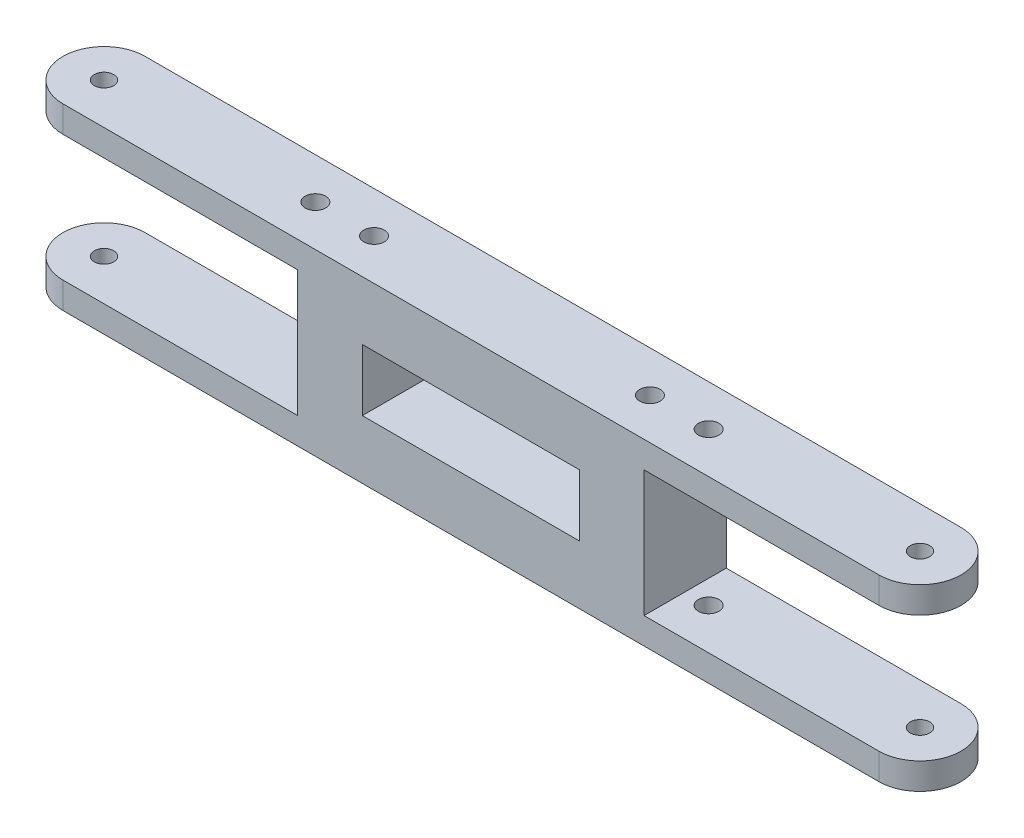
from build123d import *

# Parameters (mm, degrees)
SKETCH_1_R          = 1.65
SKETCH_1_R_2        = 1.75
EXTRUDE_1_DEPTH     = 30.5
CUT_EXTRUDE_1_DEPTH = 62.051208014
SKETCH_3_W          = 20
SKETCH_3_H          = 10.5
CUT_EXTRUDE_2_DEPTH = 62.051208014
SKETCH_4_W          = 18.5
SKETCH_4_H          = 10
EXTRUDE_2_DEPTH     = 14
SKETCH_5_W          = 11
SKETCH_5_H          = 10.5
EXTRUDE_3_DEPTH     = 14


with BuildPart() as part:
    # ｽｹｯﾁ1 → ﾎﾞｽ - 押し出し1 (new body)
    with BuildSketch(Plane(origin=(0, 0, 0), x_dir=(1, 0, 0), z_dir=(0, 1, 0))):
        with BuildLine():
            Line((0, 7), (51, 7))
            Line((51, 7), (51, -7))
            Line((51, -7), (0, -7))
            ThreePointArc((0, -7), (-7, 0), (0, 7))
        make_face()
        with Locations(Location((0, 0, 0), (0, 0, 90))):
            Circle(SKETCH_1_R, mode=Mode.SUBTRACT)
        with Locations(Location((46, 0, 0), (0, 0, 90))):
            Circle(SKETCH_1_R_2, mode=Mode.SUBTRACT)
        with Locations(Location((36, 0, 0), (0, 0, 90))):
            Circle(SKETCH_1_R_2, mode=Mode.SUBTRACT)
    extrude(amount=EXTRUDE_1_DEPTH)

    # ｽｹｯﾁ2 → ｶｯﾄ - 押し出し1 (cut, through all)
    with BuildSketch(Plane.XY.offset(7)):
        Polygon((0, 26), (-7, 26), (-7, 4.5), (0, 4.5), (40, 4.5), (40, 26), align=None)
    extrude(amount=-CUT_EXTRUDE_1_DEPTH, mode=Mode.SUBTRACT)

    # ｽｹｯﾁ3 → ｶｯﾄ - 押し出し2 (cut, through all)
    with BuildSketch(Plane.XY.offset(7)):
        with Locations((41, 15.25)):
            Rectangle(SKETCH_3_W, SKETCH_3_H)
    extrude(amount=-CUT_EXTRUDE_2_DEPTH, mode=Mode.SUBTRACT)


with BuildPart() as cut_extrude_2_piece_1:
    # of the separate pieces the step leaves, piece 1, a body of its own (cut_extrude_2_pieces)
    add(part.part.solids().sort_by_distance((51, 20.5, -7))[0])


with BuildPart() as cut_extrude_2_piece_2:
    # of the separate pieces the step leaves, piece 2, a body of its own (cut_extrude_2_pieces)
    add(part.part.solids().sort_by_distance((0, 0, -7))[0])

    # ｽｹｯﾁ4 → ﾎﾞｽ - 押し出し2 (add)
    with BuildSketch(Plane.XY.offset(7)):
        with Locations((60.25, 25.5)):
            Rectangle(SKETCH_4_W, SKETCH_4_H)
        with Locations((60.25, 5)):
            Rectangle(SKETCH_4_W, SKETCH_4_H)
    extrude(amount=-EXTRUDE_2_DEPTH)


with BuildPart() as extrude_2_piece_1:
    # of the separate pieces the step leaves, piece 1, a body of its own (extrude_2_pieces)
    add(cut_extrude_2_piece_2.part.solids().sort_by_distance((0, 0, -7))[0])

    # ﾐﾗｰ1: ﾎﾞｽ - 押し出し2 piece 1 across plane


with BuildPart() as extrude_2_piece_2:
    # of the separate pieces the step leaves, piece 2, a body of its own (extrude_2_pieces)
    add(cut_extrude_2_piece_2.part.solids().sort_by_distance((51, 30.5, 7))[0])


with BuildPart() as extrude_2_piece_1_1:
    add(extrude_2_piece_1.part)
    add(extrude_2_piece_1.part.mirror(Plane(origin=(69.5, 10, -7), x_dir=(0, 0, 1), z_dir=(1, 0, 0))))


with BuildPart() as body_4:
    # ﾐﾗｰ2: mirrored copy
    add(extrude_2_piece_2.part.mirror(Plane(origin=(69.5, 30.5, -7), x_dir=(0, 0, 1), z_dir=(1, 0, 0))))


with BuildPart() as body_5:
    # Mirror 2 2: mirrored copy
    add(cut_extrude_2_piece_1.part.mirror(Plane(origin=(69.5, 30.5, -7), x_dir=(0, 0, 1), z_dir=(1, 0, 0))))


with BuildPart() as cut_extrude_2_piece_1_1:
    add(cut_extrude_2_piece_1.part)

    add(extrude_2_piece_1_1.part)  # ﾎﾞｽ - 押し出し3 merges ﾎﾞｽ - 押し出し2 piece 1

    add(extrude_2_piece_2.part)  # ﾎﾞｽ - 押し出し3 merges ﾎﾞｽ - 押し出し2 piece 2

    add(body_4.part)  # ﾎﾞｽ - 押し出し3 merges body 4

    add(body_5.part)  # ﾎﾞｽ - 押し出し3 merges body 5
    # ｽｹｯﾁ5 → ﾎﾞｽ - 押し出し3 (add)
    with BuildSketch(Plane(origin=(0, 0, -7), x_dir=(-1, 0, 0), z_dir=(0, 0, -1))):
        with Locations((-93.5, 15.25)):
            Rectangle(SKETCH_5_W, SKETCH_5_H)
        with Locations((-45.5, 15.25)):
            Rectangle(SKETCH_5_W, SKETCH_5_H)
    extrude(amount=-EXTRUDE_3_DEPTH)


solid = cut_extrude_2_piece_1_1.part
